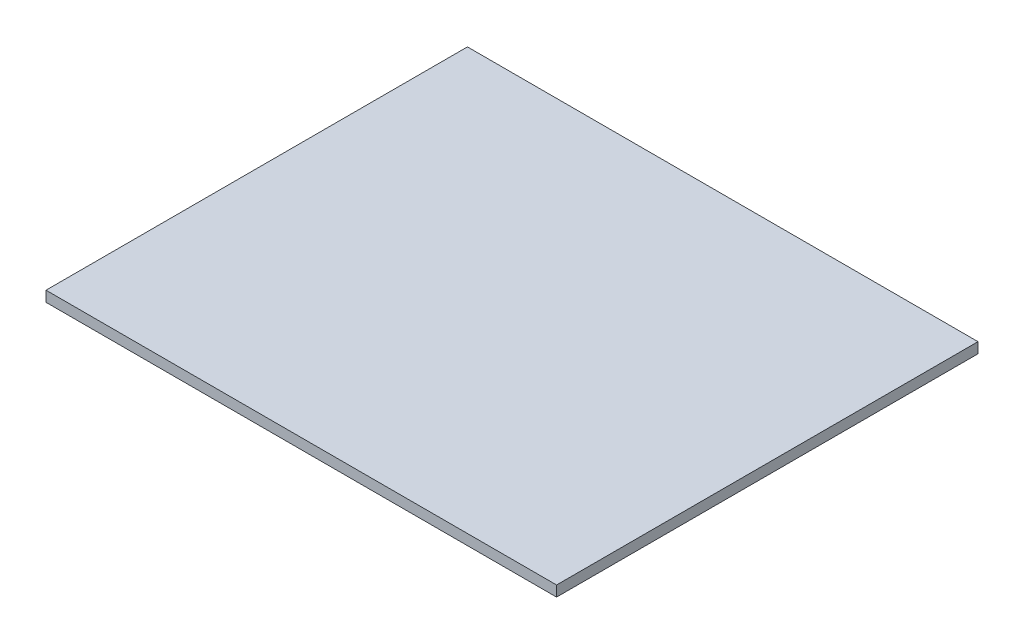
from build123d import *

# Parameters (mm, degrees)
SKETCH1_W           = 461.900016
SKETCH1_H           = 9.525
BOSS_EXTRUDE1_DEPTH = 381.25


with BuildPart() as part:
    # Sketch1 → Boss-Extrude1 (new body)
    with BuildSketch(Plane.XY):
        with Locations((0, 114.2875)):
            Rectangle(SKETCH1_W, SKETCH1_H)
    extrude(amount=BOSS_EXTRUDE1_DEPTH)


solid = part.part
